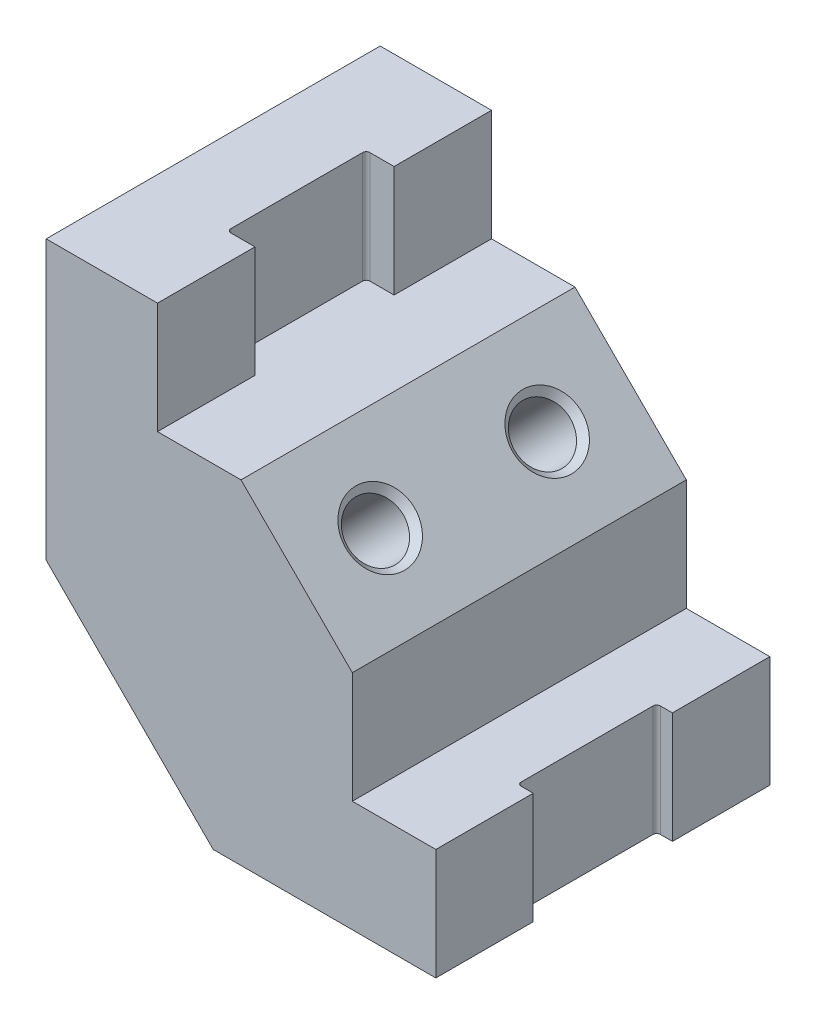
from build123d import *

# Parameters (mm, degrees)
BOSS_EXTRUDE1_DEPTH = 38.1
SKETCH2_R           = 6.35
CUT_EXTRUDE1_DEPTH  = 142.777171117
CHAMFER1_SIZE       = 1.524
SKETCH3_W           = 6.35
SKETCH3_H           = 31.75
CUT_EXTRUDE2_DEPTH  = 25.4
SKETCH4_W           = 3.590345221
SKETCH4_H           = 31.75
CUT_EXTRUDE3_DEPTH  = 124.131068378
FILLET1_R           = 0.8382


with BuildPart() as part:
    # Sketch1 → Boss-Extrude1 (new, symmetric)
    with BuildSketch(Plane.XY):
        Polygon((0, 0), (0, -63.5), (38.1, -101.6), (88.9, -101.6), (88.9, -76.2), (69.85, -76.2), (69.85, -50.8), (44.45, -25.4), (25.4, -25.4), (25.4, 0), align=None)
    extrude(amount=BOSS_EXTRUDE1_DEPTH, both=True)

    # Sketch2 → Cut-Extrude1 (cut, through all)
    with BuildSketch(Plane(origin=(9.525, 9.525, 0), x_dir=(0, 0, -1), z_dir=(0.7071067811865488, 0.7071067811865464, 0))):
        with Locations(Location((-19.05, -67.35463315, 0), (0, 0, 90))):
            Circle(SKETCH2_R)
        with Locations(Location((19.05, -67.35463315, 0), (0, 0, 90))):
            Circle(SKETCH2_R)
    extrude(amount=-CUT_EXTRUDE1_DEPTH, mode=Mode.SUBTRACT)

    # Chamfer1
    chamfer1_edges = [part.edges().sort_by_distance(p)[0] for p in [
        (20.367045905, -83.867045905, 19.05),
        (61.642045905, -42.592045905, 19.05),
        (20.367045905, -83.867045905, -19.05),
        (61.642045905, -42.592045905, -19.05),
    ]]
    chamfer(chamfer1_edges, length=CHAMFER1_SIZE)

    # Sketch3 → Cut-Extrude2 (cut)
    with BuildSketch(Plane(origin=(0, 0, 0), x_dir=(1, 0, 0), z_dir=(0, 1, 0))):
        with Locations((22.225, 0)):
            Rectangle(SKETCH3_W, SKETCH3_H)
    extrude(amount=-CUT_EXTRUDE2_DEPTH, mode=Mode.SUBTRACT)

    # Sketch4 → Cut-Extrude3 (cut, through all)
    with BuildSketch(Plane(origin=(0, -76.2, 0), x_dir=(1, 0, 0), z_dir=(0, 1, 0))):
        with Locations((87.10482739, 0)):
            Rectangle(SKETCH4_W, SKETCH4_H)
    extrude(amount=-CUT_EXTRUDE3_DEPTH, mode=Mode.SUBTRACT)

    # Fillet1
    fillet1_edges = [part.edges().sort_by_distance(p)[0] for p in [
        (19.05, -12.7, -15.875),
        (19.05, -12.7, 15.875),
        (85.309654779, -88.9, 15.875),
        (85.309654779, -88.9, -15.875),
    ]]
    fillet(fillet1_edges, radius=FILLET1_R)


solid = part.part
